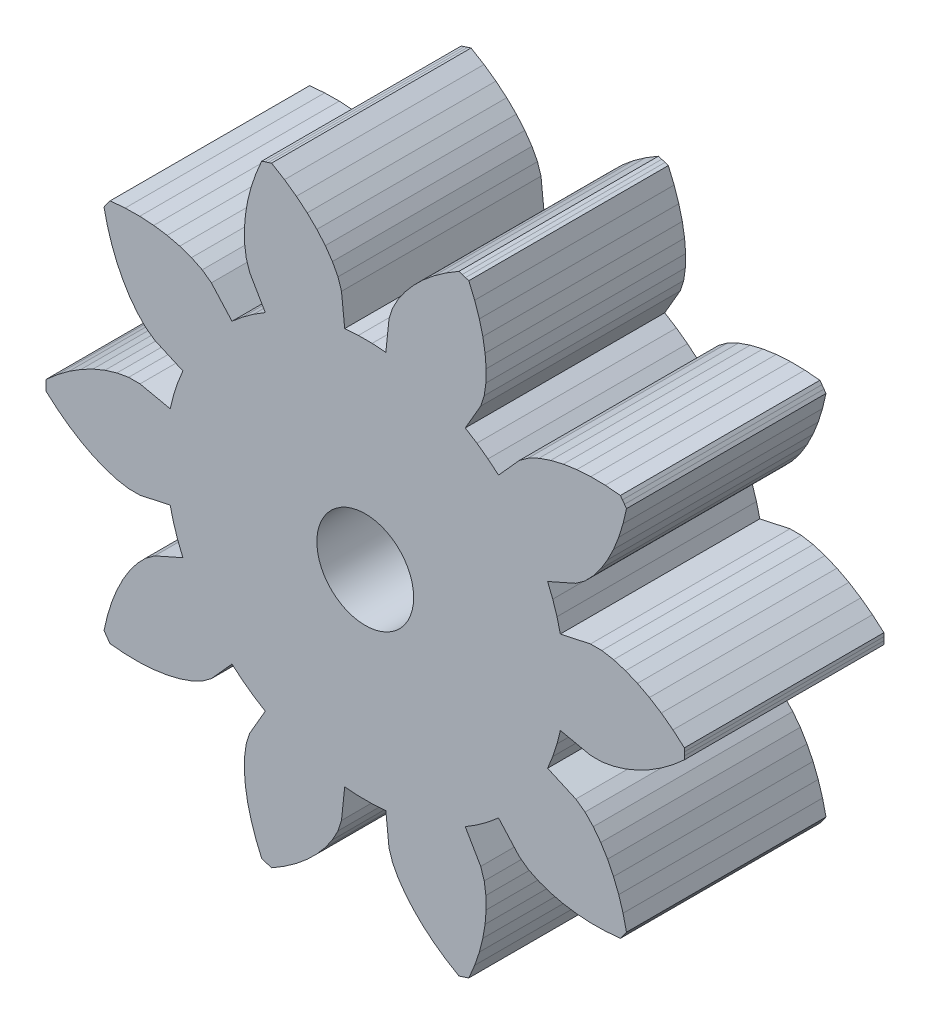
from build123d import *

# Parameters (mm, degrees)
SKETCH_1_R      = 3.638331515
EXTRUDE_1_DEPTH = 15


with BuildPart() as part:
    # 草图1 → 凸台-拉伸1 (new body)
    with BuildSketch(Plane.XY):
        Polygon((14.667859807, -3.139090424), (16.936985616, -3.624709403), (17.789702937, -3.62582912), (18.670661523, -3.470010227), (19.565562168, -3.198748648), (20.466295051, -2.824334224), (21.36602447, -2.352916109), (22.258408189, -1.788249861), (23.137339286, -1.133004053), (23.9968416, -0.389349771), (23.99964906, -0.129788318), (23.99964906, 0.129788318), (23.9968416, 0.389349771), (23.137339286, 1.133004053), (22.258408189, 1.788249861), (21.36602447, 2.352916109), (20.466295051, 2.824334224), (19.565562168, 3.198748648), (18.670661523, 3.470010227), (17.789702937, 3.62582912), (16.936985616, 3.624709403), (14.667859807, 3.139090424), (14.417005981, 4.141248428), (14.097767599, 5.123763142), (13.711658912, 6.081974177), (15.832859927, 7.022858857), (16.523380885, 7.523167652), (17.144503305, 8.167042249), (17.709049579, 8.912506878), (18.217682512, 9.744852015), (18.668486287, 10.655084965), (19.058537388, 11.636439545), (19.38446376, 12.683167275), (19.642706719, 13.789999013), (19.492411607, 14.001638823), (19.339836289, 14.211640732), (19.184998612, 14.419980175), (18.052537613, 14.516406343), (16.956323597, 14.529888601), (15.902467509, 14.462183202), (14.897478504, 14.314720785), (13.948695017, 14.088190912), (13.065261632, 13.781636738), (12.260963117, 13.389882406), (11.571758466, 12.88776187), (10.021436798, 11.161129177), (9.229438095, 11.824443854), (8.393661159, 12.431671341), (7.518070354, 12.979931361), (8.681119886, 14.987933731), (8.945688944, 15.798570084), (9.069727545, 16.684562174), (9.08828196, 17.619487702), (9.01053445, 18.591835999), (8.840220861, 19.593205735), (8.578953081, 20.616404553), (8.227381932, 21.65479979), (7.785725502, 22.702036878), (7.539735444, 22.784915831), (7.292863393, 22.865129423), (7.045138229, 22.94266827), (6.072280156, 22.355034804), (5.177499715, 21.721603748), (4.364708465, 21.047387863), (3.638331515, 20.337370545), (3.003900469, 19.596423087), (2.469375869, 18.829146436), (2.048952121, 18.039455718), (1.786512892, 17.228127341), (1.547165548, 14.919995937), (0.516538553, 14.991103626), (-0.516538553, 14.991103626), (-1.547165548, 14.919995937), (-1.786512892, 17.228127341), (-2.048952121, 18.039455718), (-2.469375869, 18.829146436), (-3.003900469, 19.596423087), (-3.638331515, 20.337370545), (-4.364708465, 21.047387863), (-5.177499715, 21.721603748), (-6.072280156, 22.355034804), (-7.045138229, 22.94266827), (-7.292863393, 22.865129423), (-7.539735444, 22.784915831), (-7.785725502, 22.702036878), (-8.227381932, 21.65479979), (-8.578953081, 20.616404553), (-8.840220861, 19.593205735), (-9.01053445, 18.591835999), (-9.08828196, 17.619487702), (-9.069727545, 16.684562174), (-8.945688944, 15.798570084), (-8.681119886, 14.987933731), (-7.518070354, 12.979931361), (-8.393661159, 12.431671341), (-9.229438095, 11.824443854), (-10.021436798, 11.161129177), (-11.571758466, 12.88776187), (-12.260963117, 13.389882406), (-13.065261632, 13.781636738), (-13.948695017, 14.088190912), (-14.897478504, 14.314720785), (-15.902467509, 14.462183202), (-16.956323597, 14.529888601), (-18.052537613, 14.516406343), (-19.184998612, 14.419980175), (-19.339836289, 14.211640732), (-19.492411607, 14.001638823), (-19.642706719, 13.789999013), (-19.38446376, 12.683167275), (-19.058537388, 11.636439545), (-18.668486287, 10.655084965), (-18.217682512, 9.744852015), (-17.709049579, 8.912506878), (-17.144503305, 8.167042249), (-16.523380885, 7.523167652), (-15.832859927, 7.022858857), (-13.711658912, 6.081974177), (-14.097767599, 5.123763142), (-14.417005981, 4.141248428), (-14.667859807, 3.139090424), (-16.936985616, 3.624709403), (-17.789702937, 3.62582912), (-18.670661523, 3.470010227), (-19.565562168, 3.198748648), (-20.466295051, 2.824334224), (-21.36602447, 2.352916109), (-22.258408189, 1.788249861), (-23.137339286, 1.133004053), (-23.9968416, 0.389349771), (-23.99964906, 0.129788318), (-23.99964906, -0.129788318), (-23.9968416, -0.389349771), (-23.137339286, -1.133004053), (-22.258408189, -1.788249861), (-21.36602447, -2.352916109), (-20.466295051, -2.824334224), (-19.565562168, -3.198748648), (-18.670661523, -3.470010227), (-17.789702937, -3.62582912), (-16.936985616, -3.624709403), (-14.667859807, -3.139090424), (-14.417005981, -4.141248428), (-14.097767599, -5.123763142), (-13.711658912, -6.081974177), (-15.832859927, -7.022858857), (-16.523380885, -7.523167652), (-17.144503305, -8.167042249), (-17.709049579, -8.912506878), (-18.217682512, -9.744852015), (-18.668486287, -10.655084965), (-19.058537388, -11.636439545), (-19.38446376, -12.683167275), (-19.642706719, -13.789999013), (-19.492411607, -14.001638823), (-19.339836289, -14.211640732), (-19.184998612, -14.419980175), (-18.052537613, -14.516406343), (-16.956323597, -14.529888601), (-15.902467509, -14.462183202), (-14.897478504, -14.314720785), (-13.948695017, -14.088190912), (-13.065261632, -13.781636738), (-12.260963117, -13.389882406), (-11.571758466, -12.88776187), (-10.021436798, -11.161129177), (-9.229438095, -11.824443854), (-8.393661159, -12.431671341), (-7.518070354, -12.979931361), (-8.681119886, -14.987933731), (-8.945688944, -15.798570084), (-9.069727545, -16.684562174), (-9.08828196, -17.619487702), (-9.01053445, -18.591835999), (-8.840220861, -19.593205735), (-8.578953081, -20.616404553), (-8.227381932, -21.65479979), (-7.785725502, -22.702036878), (-7.539735444, -22.784915831), (-7.292863393, -22.865129423), (-7.045138229, -22.94266827), (-6.072280156, -22.355034804), (-5.177499715, -21.721603748), (-4.364708465, -21.047387863), (-3.638331515, -20.337370545), (-3.003900469, -19.596423087), (-2.469375869, -18.829146436), (-2.048952121, -18.039455718), (-1.786512892, -17.228127341), (-1.547165548, -14.919995937), (-0.516538553, -14.991103626), (0.516538553, -14.991103626), (1.547165548, -14.919995937), (1.786512892, -17.228127341), (2.048952121, -18.039455718), (2.469375869, -18.829146436), (3.003900469, -19.596423087), (3.638331515, -20.337370545), (4.364708465, -21.047387863), (5.177499715, -21.721603748), (6.072280156, -22.355034804), (7.045138229, -22.94266827), (7.292863393, -22.865129423), (7.539735444, -22.784915831), (7.785725502, -22.702036878), (8.227381932, -21.65479979), (8.578953081, -20.616404553), (8.840220861, -19.593205735), (9.01053445, -18.591835999), (9.08828196, -17.619487702), (9.069727545, -16.684562174), (8.945688944, -15.798570084), (8.681119886, -14.987933731), (7.518070354, -12.979931361), (8.393661159, -12.431671341), (9.229438095, -11.824443854), (10.021436798, -11.161129177), (11.571758466, -12.88776187), (12.260963117, -13.389882406), (13.065261632, -13.781636738), (13.948695017, -14.088190912), (14.897478504, -14.314720785), (15.902467509, -14.462183202), (16.956323597, -14.529888601), (18.052537613, -14.516406343), (19.184998612, -14.419980175), (19.339836289, -14.211640732), (19.492411607, -14.001638823), (19.642706719, -13.789999013), (19.38446376, -12.683167275), (19.058537388, -11.636439545), (18.668486287, -10.655084965), (18.217682512, -9.744852015), (17.709049579, -8.912506878), (17.144503305, -8.167042249), (16.523380885, -7.523167652), (15.832859927, -7.022858857), (13.711658912, -6.081974177), (14.097767599, -5.123763142), (14.417005981, -4.141248428), align=None)
        Circle(SKETCH_1_R, mode=Mode.SUBTRACT)
    extrude(amount=EXTRUDE_1_DEPTH)


solid = part.part
